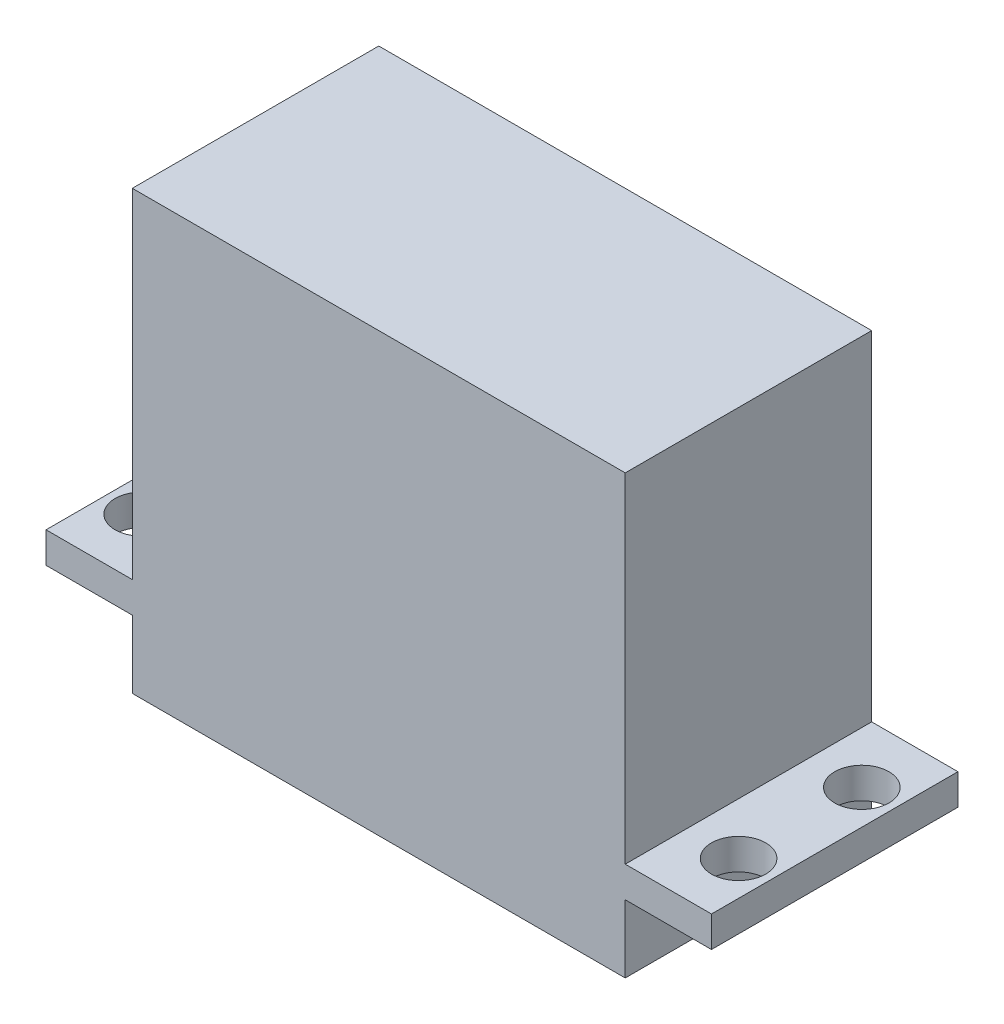
from build123d import *

# Parameters (mm, degrees)
SKETCH_1_W               = 40
SKETCH_1_H               = 20
EXTRUDE_2_DEPTH          = 30
SKETCH_3_W               = 54
SKETCH_3_H               = 20
EXTRUDE_3_DEPTH          = 2.5
CUT_EXTRUDE_3_DEPTH      = 42.581245773
CUT_EXTRUDE_3_DEPTH_BACK = 42.581245773
SKETCH_4_R               = 2.2
SKETCH_5_W               = 40
SKETCH_5_H               = 20
EXTRUDE_4_DEPTH          = 5.5
EXTRUDE_START            = -5.5
SKETCH_6_R               = 3
EXTRUDE_5_DEPTH          = 7


with BuildPart() as part:
    # 草图1 → 凸台-拉伸2 (new body)
    with BuildSketch(Plane(origin=(0, 0, 0), x_dir=(1, 0, 0), z_dir=(0, 1, 0))):
        Rectangle(SKETCH_1_W, SKETCH_1_H)
    extrude(amount=EXTRUDE_2_DEPTH)

    # 草图3 → 凸台-拉伸3 (add)
    with BuildSketch(Plane(origin=(0, 0, 0), x_dir=(1, 0, 0), z_dir=(0, 1, 0))):
        Rectangle(SKETCH_3_W, SKETCH_3_H)
    extrude(amount=EXTRUDE_3_DEPTH)

    # 草图4 → 切除-拉伸3 (cut, two sides: drawn at the far end of the back side and taken through both)
    with BuildSketch(Plane(origin=(0, 0, 0), x_dir=(1, 0, 0), z_dir=(0, 1, 0)).offset(-CUT_EXTRUDE_3_DEPTH_BACK)):
        with Locations(Location((-24.2, -5, 0), (0, 0, 270))):
            Circle(SKETCH_4_R)
        with Locations(Location((-24.2, 5, 0), (0, 0, 270))):
            Circle(SKETCH_4_R)
        with Locations(Location((24.2, -5, 0), (0, 0, 270))):
            Circle(SKETCH_4_R)
        with Locations(Location((24.2, 5, 0), (0, 0, 270))):
            Circle(SKETCH_4_R)
    extrude(amount=CUT_EXTRUDE_3_DEPTH + CUT_EXTRUDE_3_DEPTH_BACK, mode=Mode.SUBTRACT)

    # 草图5 → 凸台-拉伸4 (add)
    with BuildSketch(Plane(origin=(0, 0, 0), x_dir=(1, 0, 0), z_dir=(0, 1, 0))):
        Rectangle(SKETCH_5_W, SKETCH_5_H)
    extrude(amount=-EXTRUDE_4_DEPTH)

    # 草图6 → 凸台-拉伸5 (add)
    with BuildSketch(Plane(origin=(0, 0, 0), x_dir=(1, 0, 0), z_dir=(0, 1, 0)).offset(EXTRUDE_START)):
        with Locations(Location((-10, 0, 0), (0, 0, 90))):
            Circle(SKETCH_6_R)
    extrude(amount=-EXTRUDE_5_DEPTH)


solid = part.part
